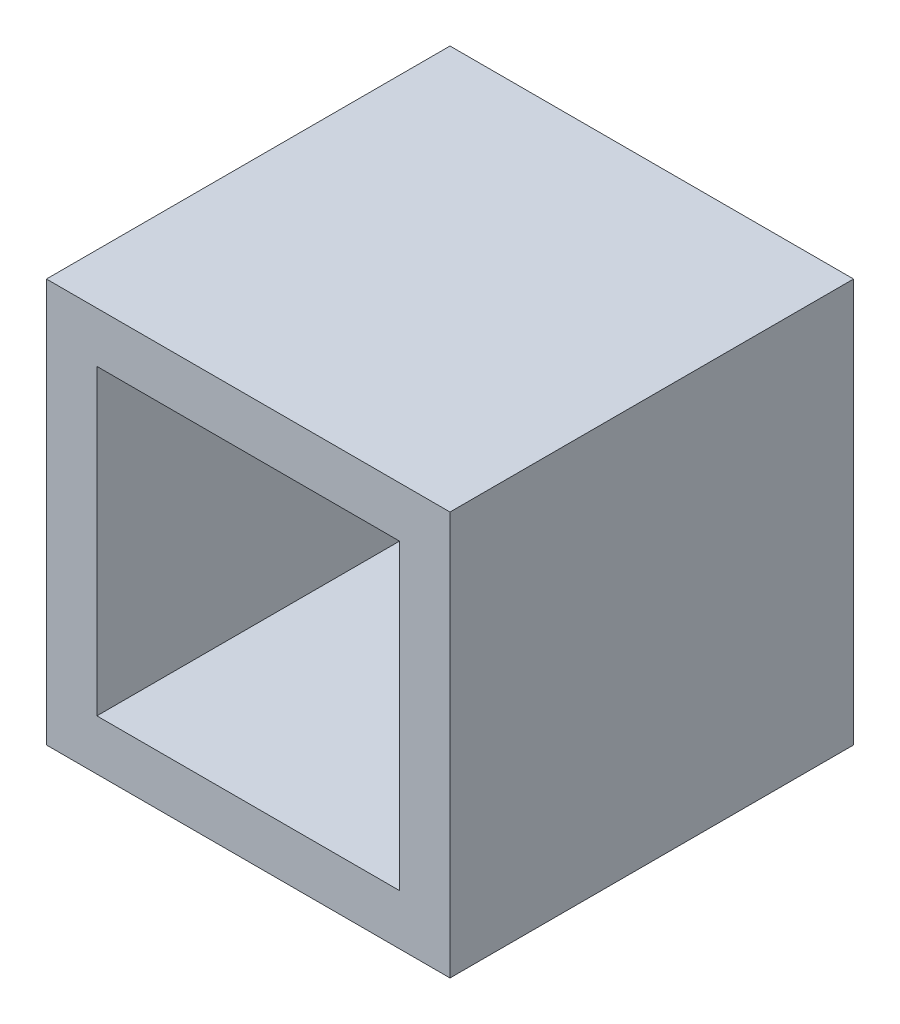
from build123d import *

# Parameters (mm, degrees)
SKETCH1_W           = 25.4
SKETCH1_H           = 25.4
SKETCH1_W_2         = 19.05
SKETCH1_H_2         = 19.05
BOSS_EXTRUDE1_DEPTH = 25.4


with BuildPart() as part:
    # Sketch1 → Boss-Extrude1 (new body)
    with BuildSketch(Plane.XY):
        Rectangle(SKETCH1_W, SKETCH1_H)
        Rectangle(SKETCH1_W_2, SKETCH1_H_2, mode=Mode.SUBTRACT)
    extrude(amount=BOSS_EXTRUDE1_DEPTH)


solid = part.part
